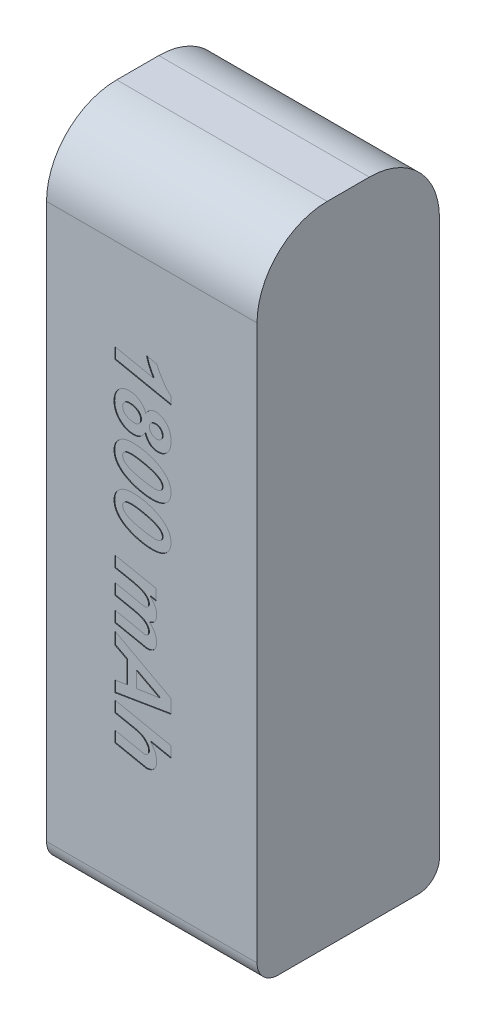
from build123d import *

# Parameters (mm, degrees)
SKETCH1_W           = 30
SKETCH1_H           = 92
BOSS_EXTRUDE1_DEPTH = 26
FILLET1_R           = 10
FILLET2_R           = 3
CUT_EXTRUDE1_DEPTH  = 0.1


with BuildPart() as part:
    # Sketch1 → Boss-Extrude1 (new body)
    with BuildSketch(Plane.XY):
        Rectangle(SKETCH1_W, SKETCH1_H)
    extrude(amount=BOSS_EXTRUDE1_DEPTH)

    # Fillet1
    fillet1_edges = [part.edges().sort_by_distance(p)[0] for p in [
        (0, 46, 0),
        (0, 46, 26),
    ]]
    fillet(fillet1_edges, radius=FILLET1_R)

    # Fillet2
    fillet2_edges = [part.edges().sort_by_distance(p)[0] for p in [
        (0, -46, 26),
        (0, -46, 0),
    ]]
    fillet(fillet2_edges, radius=FILLET2_R)

    # Sketch2 → Cut-Extrude1 (cut)
    # profile 1 of 7: a face of its own
    with BuildSketch(Plane.XY.offset(26)):
        with BuildLine():
            Line((-0.750042616, 24.085480055), (0.690466643, 23.7767995))
            add(Edge.make_bspline(
                [(0.690466643, 23.7767995), (0.764245784, 23.620240153), (0.909160156, 23.312731836), (1.143525697, 22.870871551), (1.389006546, 22.457088896), (1.639855318, 22.068663084), (1.903368827, 21.709753131), (2.172427788, 21.375970632), (2.452578988, 21.070104803), (2.650695005, 20.884408422), (2.748337014, 20.792887463)],
                knots=[0, 0, 0, 0, 1.138131727, 2.235477977, 3.287822432, 4.301550447, 5.275074112, 6.214672494, 7.120096559, 8, 8, 8, 8], degree=3))
            Line((2.748337014, 20.792887463), (2.748337014, 19.733405764))
            Line((2.748337014, 19.733405764), (-5.277357431, 21.381309772))
            Line((-5.277357431, 21.381309772), (-5.277357431, 22.953651352))
            Line((-5.277357431, 22.953651352), (0.229053521, 21.823430359))
            add(Edge.make_bspline(
                [(0.229053521, 21.823430359), (0.175070155, 21.907004417), (0.064699865, 22.077873589), (-0.086493138, 22.350370315), (-0.233830594, 22.639855267), (-0.368468606, 22.943873736), (-0.492353739, 23.247537552), (-0.596329622, 23.541458011), (-0.685721571, 23.817267876), (-0.72915109, 23.99836453), (-0.750042616, 24.085480055)],
                knots=[0, 0, 0, 0, 0.963964861, 1.970849335, 3.018369519, 4.11099744, 5.192122585, 6.195827564, 7.132113005, 8, 8, 8, 8], degree=3))
        make_face()
    # profile 2 of 7: a face of its own
    with BuildSketch(Plane.XY.offset(26)):
        with BuildLine():
            add(Edge.make_bspline(
                [(-0.854543846, 16.905441716), (-0.808427004, 16.97731352), (-0.719137657, 17.116468461), (-0.563452514, 17.300335025), (-0.398535746, 17.457168951), (-0.222147883, 17.585016432), (-0.036092485, 17.686336725), (0.16107307, 17.757832289), (0.368170212, 17.80041449), (0.509670799, 17.806102454), (0.58114228, 17.808975426)],
                knots=[0, 0, 0, 0, 1.151289584, 2.229074894, 3.242024708, 4.215537115, 5.160342733, 6.091432162, 7.035988663, 8, 8, 8, 8], degree=3))
            add(Edge.make_bspline(
                [(0.58114228, 17.808975426), (0.666588229, 17.804812124), (0.840212385, 17.796352392), (1.101228464, 17.7404634), (1.361444034, 17.642021904), (1.621756104, 17.51431141), (1.870847457, 17.349176291), (2.093996428, 17.141459407), (2.287236427, 16.895964572), (2.452266135, 16.617495125), (2.585396775, 16.311454624), (2.680099977, 15.982383488), (2.737552858, 15.633612839), (2.744686411, 15.394416227), (2.748337014, 15.27200711)],
                knots=[0, 0, 0, 0, 0.827973999, 1.682423677, 2.572802156, 3.51794388, 4.487184314, 5.457217265, 6.458746256, 7.504230222, 8.585616686, 9.683336227, 10.814444883, 12, 12, 12, 12], degree=3))
            add(Edge.make_bspline(
                [(2.748337014, 15.27200711), (2.747029902, 15.184048034), (2.744489347, 15.013087218), (2.717970662, 14.763707607), (2.67567946, 14.528988524), (2.61383824, 14.309240384), (2.537679643, 14.103886126), (2.441369575, 13.914142273), (2.329527803, 13.738011795), (2.198295057, 13.579423425), (2.056608665, 13.436733293), (1.903444077, 13.312865294), (1.741203122, 13.208187401), (1.569386643, 13.123055429), (1.389682099, 13.053442435), (1.199120079, 13.008791387), (1.000142268, 12.978034408), (0.864222633, 12.974686106), (0.794967873, 12.972980055)],
                knots=[0, 0, 0, 0, 1.243087479, 2.416115084, 3.541007917, 4.610847531, 5.639465507, 6.632218593, 7.613661446, 8.582774162, 9.536362877, 10.452184577, 11.362158741, 12.260035995, 13.159190913, 14.079794841, 15.021603112, 16, 16, 16, 16], degree=3))
            add(Edge.make_bspline(
                [(0.794967873, 12.972980055), (0.746126902, 12.973551529), (0.649713385, 12.974679635), (0.507557197, 12.994380497), (0.369247518, 13.019755309), (0.237030171, 13.061519097), (0.109176198, 13.110876281), (-0.014208067, 13.17259483), (-0.132118705, 13.246422356), (-0.245851039, 13.330530388), (-0.353571283, 13.426580263), (-0.459089116, 13.531906081), (-0.555695812, 13.652435305), (-0.651836356, 13.780217608), (-0.739502074, 13.921680352), (-0.825048692, 14.072518867), (-0.905590647, 14.235153346), (-0.953734566, 14.348920107), (-0.97833761, 14.40705847)],
                knots=[0, 0, 0, 0, 0.961053458, 1.897147852, 2.822468421, 3.727334701, 4.623105372, 5.519994748, 6.439699394, 7.3601306, 8.302452841, 9.280228522, 10.292491547, 11.341721621, 12.428147908, 13.567190665, 14.756758571, 16, 16, 16, 16], degree=3))
            add(Edge.make_bspline(
                [(-0.97833761, 14.40705847), (-1.028815572, 14.325223733), (-1.126690858, 14.166548582), (-1.303462231, 13.958427892), (-1.491289072, 13.777940363), (-1.699441822, 13.634491167), (-1.922014456, 13.521394152), (-2.160721504, 13.443497206), (-2.414054326, 13.393028901), (-2.588479566, 13.387421833), (-2.677688377, 13.384554129)],
                knots=[0, 0, 0, 0, 1.104819615, 2.142212779, 3.13242676, 4.09372825, 5.039579334, 5.995029153, 6.974568898, 8, 8, 8, 8], degree=3))
            add(Edge.make_bspline(
                [(-2.677688377, 13.384554129), (-2.751704312, 13.38669719), (-2.899097229, 13.39096481), (-3.117709381, 13.416341741), (-3.331137875, 13.46189882), (-3.538802736, 13.525383267), (-3.742564906, 13.603134026), (-3.939298182, 13.703372608), (-4.132879105, 13.817739578), (-4.254537301, 13.908082132), (-4.315946117, 13.953683904)],
                knots=[0, 0, 0, 0, 1.005550638, 2.00242071, 2.984724643, 3.965786964, 4.949950379, 5.94290545, 6.961650381, 8, 8, 8, 8], degree=3))
            add(Edge.make_bspline(
                [(-4.315946117, 13.953683904), (-4.400656404, 14.024233065), (-4.567316251, 14.163032174), (-4.785749211, 14.399407393), (-4.969559331, 14.656181873), (-5.118631027, 14.932198005), (-5.238217126, 15.226112655), (-5.320778623, 15.540009343), (-5.371898215, 15.872677527), (-5.377428106, 16.100860698), (-5.380250949, 16.217341311)],
                knots=[0, 0, 0, 0, 1.018279677, 2.003373381, 2.965682026, 3.929990586, 4.896840818, 5.891837577, 6.923846788, 8, 8, 8, 8], degree=3))
            add(Edge.make_bspline(
                [(-5.380250949, 16.217341311), (-5.37847832, 16.302103313), (-5.375000832, 16.468386798), (-5.345444047, 16.710962307), (-5.298284551, 16.941278059), (-5.227468632, 17.157436298), (-5.142422634, 17.363097198), (-5.032164793, 17.553234816), (-4.907905694, 17.73370191), (-4.760083475, 17.896098232), (-4.60129138, 18.045974345), (-4.42783548, 18.174485994), (-4.245562392, 18.285478368), (-4.051341501, 18.373439302), (-3.847365267, 18.443355085), (-3.632394477, 18.492624184), (-3.406929114, 18.524366952), (-3.252822172, 18.527590924), (-3.174471146, 18.529230055)],
                knots=[0, 0, 0, 0, 1.1327941, 2.222280578, 3.26208437, 4.270334757, 5.25905053, 6.231222848, 7.20318395, 8.182510492, 9.160893155, 10.118060599, 11.062922249, 12.008652688, 12.962489536, 13.940898431, 14.953111921, 16, 16, 16, 16], degree=3))
            add(Edge.make_bspline(
                [(-3.174471146, 18.529230055), (-3.108490102, 18.528195405), (-2.978327886, 18.526154329), (-2.786086942, 18.50388829), (-2.598826008, 18.470970442), (-2.417358102, 18.422216398), (-2.240729214, 18.361271108), (-2.070260706, 18.28494067), (-1.903793966, 18.196522156), (-1.744163536, 18.094277267), (-1.593180254, 17.979667252), (-1.451260109, 17.856700624), (-1.322363281, 17.722125881), (-1.204295973, 17.579219092), (-1.099485411, 17.424647198), (-1.004921185, 17.261600741), (-0.921679657, 17.088071768), (-0.877148369, 16.966932972), (-0.854543846, 16.905441716)],
                knots=[0, 0, 0, 0, 1.045558724, 2.062596037, 3.064149922, 4.057453873, 5.03817922, 6.023310694, 7.015342134, 8.024041474, 9.024874402, 10.018323679, 10.997723323, 11.975684761, 12.953646199, 13.954767572, 14.961819704, 16, 16, 16, 16], degree=3))
        make_face()
        with BuildLine():
            add(Edge.make_bspline(
                [(0.466994783, 16.265572648), (0.409403636, 16.263445786), (0.298567213, 16.259352556), (0.140886899, 16.218353552), (0.001361327, 16.149229384), (-0.119573872, 16.056354906), (-0.217214854, 15.941157047), (-0.287188837, 15.80833091), (-0.330876053, 15.659476365), (-0.335871813, 15.55474174), (-0.338468542, 15.500302104)],
                knots=[0, 0, 0, 0, 1.106364575, 2.129242073, 3.106838711, 4.084435348, 5.042921873, 5.988509993, 6.954454809, 8, 8, 8, 8], degree=3))
            add(Edge.make_bspline(
                [(-0.338468542, 15.500302104), (-0.334979541, 15.436562266), (-0.328085892, 15.31062358), (-0.265642085, 15.129328479), (-0.169798875, 14.95939766), (-0.036774397, 14.807911985), (0.120548957, 14.679802435), (0.295778394, 14.58474368), (0.485502333, 14.527734456), (0.61613113, 14.520204467), (0.682428087, 14.516382833)],
                knots=[0, 0, 0, 0, 0.973996038, 1.924444518, 2.906335947, 3.948464692, 4.993694825, 6.000375204, 6.985146891, 8, 8, 8, 8], degree=3))
            add(Edge.make_bspline(
                [(0.682428087, 14.516382833), (0.741679781, 14.5183113), (0.855921134, 14.522029517), (1.017630527, 14.565820886), (1.162680404, 14.633445662), (1.286927187, 14.729529934), (1.38888348, 14.845950061), (1.460874314, 14.982083879), (1.506087082, 15.132505567), (1.511059181, 15.238451938), (1.513614792, 15.292907356)],
                knots=[0, 0, 0, 0, 1.111341082, 2.142742289, 3.125290229, 4.10276144, 5.074398193, 6.012107247, 6.978242197, 8, 8, 8, 8], degree=3))
            add(Edge.make_bspline(
                [(1.513614792, 15.292907356), (1.509982731, 15.357659955), (1.502845439, 15.484904033), (1.443470408, 15.668159562), (1.347181072, 15.836779565), (1.212733224, 15.983716058), (1.055559446, 16.109807244), (0.875263298, 16.201523658), (0.676481236, 16.256168297), (0.538082706, 16.26238134), (0.466994783, 16.265572648)],
                knots=[0, 0, 0, 0, 0.97681722, 1.919524607, 2.880974977, 3.890620521, 4.911477692, 5.911263244, 6.927127631, 8, 8, 8, 8], degree=3))
        make_face(mode=Mode.SUBTRACT)
        with BuildLine():
            add(Edge.make_bspline(
                [(-3.201802237, 16.985827278), (-3.271702086, 16.983315658), (-3.404966137, 16.978527256), (-3.59361765, 16.935244626), (-3.758236275, 16.860072568), (-3.897355637, 16.756927516), (-4.008815302, 16.629648409), (-4.088626297, 16.482509718), (-4.137009531, 16.316775854), (-4.142617137, 16.200529022), (-4.145528727, 16.140171172)],
                knots=[0, 0, 0, 0, 1.173668912, 2.237599585, 3.228987459, 4.194508581, 5.126513387, 6.049465778, 6.987240761, 8, 8, 8, 8], degree=3))
            add(Edge.make_bspline(
                [(-4.145528727, 16.140171172), (-4.144074451, 16.092903497), (-4.141244788, 16.000932187), (-4.116470912, 15.866686526), (-4.074940998, 15.741045031), (-4.015831485, 15.624329631), (-3.943087519, 15.514728042), (-3.851707003, 15.414429005), (-3.743310766, 15.32335235), (-3.580003177, 15.212445595), (-3.357127164, 15.099385125), (-3.074359865, 15.000385034), (-2.780048635, 14.938449371), (-2.579379882, 14.931470933), (-2.478332185, 14.927956907)],
                knots=[0, 0, 0, 0, 0.742320717, 1.444374164, 2.136814516, 2.814762733, 3.494487192, 4.198104852, 4.938943078, 5.714487978, 7.296479243, 8.849328569, 10.413464543, 12, 12, 12, 12], degree=3))
            add(Edge.make_bspline(
                [(-2.478332185, 14.927956907), (-2.414729084, 14.930125022), (-2.29206288, 14.934306491), (-2.117954271, 14.983947488), (-1.960360748, 15.058934066), (-1.825351816, 15.167249632), (-1.711858828, 15.295473085), (-1.63218188, 15.446155987), (-1.58133338, 15.612272326), (-1.575963192, 15.729282259), (-1.573190764, 15.789690125)],
                knots=[0, 0, 0, 0, 1.087996936, 2.098332519, 3.081017277, 4.063142799, 5.047374551, 5.997568811, 6.966219445, 8, 8, 8, 8], degree=3))
            add(Edge.make_bspline(
                [(-1.573190764, 15.789690125), (-1.574299201, 15.828366812), (-1.576502024, 15.905229903), (-1.598185459, 16.018799117), (-1.634223957, 16.128519017), (-1.68205491, 16.235504456), (-1.746582242, 16.337718097), (-1.823252329, 16.437105072), (-1.915121576, 16.532563699), (-2.017983045, 16.625083047), (-2.133194821, 16.709592613), (-2.258169495, 16.784844751), (-2.393357681, 16.846543007), (-2.537110238, 16.89915807), (-2.690569674, 16.936118541), (-2.852427343, 16.966509216), (-3.02414704, 16.981319862), (-3.141761458, 16.984303941), (-3.201802237, 16.985827278)],
                knots=[0, 0, 0, 0, 0.827876832, 1.645259083, 2.465779707, 3.298102399, 4.148751074, 5.048934446, 5.98282208, 6.982951801, 8.009357285, 9.039096096, 10.102337211, 11.188148193, 12.313069887, 13.479578783, 14.713354584, 16, 16, 16, 16], degree=3))
        make_face(mode=Mode.SUBTRACT)
    # profile 3 of 7: a face of its own
    with BuildSketch(Plane.XY.offset(26)):
        with BuildLine():
            add(Edge.make_bspline(
                [(-2.65518042, 12.355618944), (-2.554938167, 12.354356506), (-2.353735613, 12.351822586), (-2.051722684, 12.331999367), (-1.748864005, 12.299178586), (-1.444469387, 12.256655), (-1.139382419, 12.198391878), (-0.833567191, 12.126651416), (-0.525994528, 12.046355028), (-0.323161883, 11.980430533), (-0.221105622, 11.947260293)],
                knots=[0, 0, 0, 0, 0.970574475, 1.948101311, 2.929147607, 3.91983513, 4.923296139, 5.935307402, 6.961139578, 8, 8, 8, 8], degree=3))
            add(Edge.make_bspline(
                [(-0.221105622, 11.947260293), (-0.099632304, 11.904834034), (0.137597962, 11.82197804), (0.478375384, 11.684435307), (0.794137544, 11.536135361), (1.086459724, 11.380087943), (1.355471301, 11.215655566), (1.598862148, 11.039075814), (1.820054406, 10.856949496), (2.015735277, 10.664289334), (2.187645473, 10.464836666), (2.338317727, 10.260739696), (2.464691387, 10.050200038), (2.568378221, 9.83390235), (2.648523881, 9.61184539), (2.707535634, 9.384944688), (2.741890916, 9.151974781), (2.746175466, 8.99454167), (2.748337014, 8.915116919)],
                knots=[0, 0, 0, 0, 1.35856178, 2.653191485, 3.878435275, 5.04050051, 6.150819564, 7.204674358, 8.213237606, 9.173610805, 10.100437584, 10.991199894, 11.849109469, 12.68944495, 13.520044858, 14.338058013, 15.161552938, 16, 16, 16, 16], degree=3))
            add(Edge.make_bspline(
                [(2.748337014, 8.915116919), (2.746102236, 8.836231637), (2.741704889, 8.681009989), (2.709183277, 8.453528234), (2.654835585, 8.236616927), (2.57646161, 8.031150058), (2.478537764, 7.835369008), (2.357018263, 7.650886417), (2.212189963, 7.478716261), (2.049190116, 7.315745411), (1.863703707, 7.169538762), (1.658286234, 7.041072663), (1.431133699, 6.936226104), (1.186332324, 6.846677041), (0.920372401, 6.780579123), (0.635798681, 6.7303431), (0.33038911, 6.701714262), (0.120323654, 6.698257668), (0.012012506, 6.696475426)],
                knots=[0, 0, 0, 0, 0.952593624, 1.874407366, 2.76926009, 3.64807316, 4.525192096, 5.408475348, 6.309347799, 7.238495603, 8.187740599, 9.155865717, 10.157722511, 11.204031341, 12.299844695, 13.462986106, 14.691898745, 16, 16, 16, 16], degree=3))
            add(Edge.make_bspline(
                [(0.012012506, 6.696475426), (-0.090392021, 6.697447001), (-0.297057149, 6.699407763), (-0.609109083, 6.724059929), (-0.925685276, 6.758471171), (-1.246907555, 6.809001266), (-1.571756722, 6.873414286), (-1.901916771, 6.950387451), (-2.234941011, 7.044536866), (-2.569678218, 7.148612428), (-2.896016987, 7.266185829), (-3.206674596, 7.394844102), (-3.498521403, 7.532007857), (-3.768541751, 7.682650664), (-4.021049191, 7.839598939), (-4.252597198, 8.008367263), (-4.464241785, 8.187403341), (-4.65553028, 8.375473864), (-4.827347275, 8.570851961), (-4.972819215, 8.776464872), (-5.100511144, 8.985203401), (-5.200852377, 9.202252696), (-5.283610881, 9.423566263), (-5.338558799, 9.652539221), (-5.374017553, 9.887206939), (-5.378160765, 10.045744058), (-5.380250949, 10.125723473)],
                knots=[0, 0, 0, 0, 1.050806483, 2.120658748, 3.210973163, 4.318753979, 5.456804918, 6.609528892, 7.79725842, 9.008045952, 10.206842645, 11.356004784, 12.458241288, 13.51444672, 14.527774803, 15.508034718, 16.45247093, 17.370395003, 18.259351987, 19.118717754, 19.952604299, 20.767053424, 21.569225787, 22.373657901, 23.179536685, 24, 24, 24, 24], degree=3))
            add(Edge.make_bspline(
                [(-5.380250949, 10.125723473), (-5.378033119, 10.205144323), (-5.373683588, 10.36090168), (-5.341152175, 10.588939212), (-5.286425551, 10.806248899), (-5.208731981, 11.012484715), (-5.110572836, 11.208809489), (-4.988264344, 11.392702259), (-4.846479869, 11.567509862), (-4.682059228, 11.729721753), (-4.497414251, 11.877830042), (-4.291830344, 12.00766899), (-4.065487185, 12.114329127), (-3.820741571, 12.203593775), (-3.556775416, 12.27163174), (-3.273613623, 12.321800336), (-2.970882387, 12.350332345), (-2.762420731, 12.353823147), (-2.65518042, 12.355618944)],
                knots=[0, 0, 0, 0, 0.959835819, 1.88239598, 2.777973292, 3.663560688, 4.541389852, 5.425388324, 6.327874184, 7.257774346, 8.211821364, 9.184167677, 10.18961518, 11.230681958, 12.32900772, 13.480331115, 14.703790039, 16, 16, 16, 16], degree=3))
        make_face()
        with BuildLine():
            add(Edge.make_bspline(
                [(-2.978330376, 10.812216167), (-3.029793358, 10.811647484), (-3.129064735, 10.810550502), (-3.272348277, 10.800843077), (-3.403917104, 10.785218525), (-3.523308037, 10.763157038), (-3.630786976, 10.733896416), (-3.72695335, 10.699350586), (-3.811619187, 10.657897692), (-3.904294822, 10.593917786), (-4.000549358, 10.50308323), (-4.084382711, 10.374792438), (-4.137453885, 10.230970159), (-4.142797866, 10.129397442), (-4.145528727, 10.077492136)],
                knots=[0, 0, 0, 0, 1.191284648, 2.297971535, 3.322843454, 4.257211969, 5.105948726, 5.898802233, 6.620089781, 7.280788094, 8.500482449, 9.656687857, 10.802529496, 12, 12, 12, 12], degree=3))
            add(Edge.make_bspline(
                [(-4.145528727, 10.077492136), (-4.144318642, 10.042027353), (-4.141898888, 9.971109957), (-4.121601646, 9.867112657), (-4.091304138, 9.765142683), (-4.045756963, 9.667909457), (-3.988489133, 9.573170501), (-3.919085334, 9.481532489), (-3.836775281, 9.392535122), (-3.774169123, 9.338423895), (-3.741993209, 9.310613881)],
                knots=[0, 0, 0, 0, 0.948578972, 1.896832437, 2.827118289, 3.790017463, 4.761852259, 5.786166786, 6.862218838, 8, 8, 8, 8], degree=3))
            add(Edge.make_bspline(
                [(-3.741993209, 9.310613881), (-3.6923869, 9.272509587), (-3.586160094, 9.190913163), (-3.399474257, 9.085274246), (-3.181027076, 8.983244981), (-2.931149768, 8.881741373), (-2.648010074, 8.784727166), (-2.332536848, 8.690344725), (-1.984582716, 8.598464188), (-1.740585338, 8.543467789), (-1.613383545, 8.514796823)],
                knots=[0, 0, 0, 0, 0.655059745, 1.40274305, 2.242041047, 3.181963106, 4.228381407, 5.378256922, 6.633221284, 8, 8, 8, 8], degree=3))
            add(Edge.make_bspline(
                [(-1.613383545, 8.514796823), (-1.51108821, 8.493060867), (-1.312154041, 8.450790862), (-1.021789867, 8.394259203), (-0.747272236, 8.347467242), (-0.489418366, 8.309138897), (-0.247818854, 8.277540093), (-0.023066112, 8.257192135), (0.185472946, 8.243244324), (0.31906546, 8.240972262), (0.383393799, 8.239878204)],
                knots=[0, 0, 0, 0, 1.243133213, 2.417526402, 3.516130667, 4.5530903, 5.516278402, 6.41196453, 7.235318791, 8, 8, 8, 8], degree=3))
            add(Edge.make_bspline(
                [(0.383393799, 8.239878204), (0.431641473, 8.240459725), (0.525023895, 8.241585249), (0.659755842, 8.251177765), (0.784332167, 8.267111694), (0.89783585, 8.288993358), (1.001386115, 8.317956709), (1.093585584, 8.354966477), (1.176810065, 8.396142081), (1.270315841, 8.460235489), (1.365739582, 8.553785624), (1.45327138, 8.681868566), (1.505166359, 8.827213049), (1.51076699, 8.929183355), (1.513614792, 8.981033079)],
                knots=[0, 0, 0, 0, 1.141149765, 2.208672892, 3.19294589, 4.110294096, 4.940858612, 5.731783298, 6.457439898, 7.132505598, 8.405449742, 9.593782183, 10.77648959, 12, 12, 12, 12], degree=3))
            add(Edge.make_bspline(
                [(1.513614792, 8.981033079), (1.512211791, 9.014848448), (1.509431193, 9.081866917), (1.492193223, 9.181313426), (1.458294798, 9.276596959), (1.416017906, 9.370370812), (1.357740887, 9.459132233), (1.289974848, 9.547176574), (1.208447548, 9.631713075), (1.146500057, 9.683110105), (1.114902407, 9.709326265)],
                knots=[0, 0, 0, 0, 0.943746662, 1.870405658, 2.801756019, 3.758205726, 4.73282665, 5.755564179, 6.855177262, 8, 8, 8, 8], degree=3))
            add(Edge.make_bspline(
                [(1.114902407, 9.709326265), (1.062533895, 9.748912446), (0.952792172, 9.83186794), (0.765057862, 9.942136825), (0.551276448, 10.048632992), (0.311090479, 10.154275898), (0.041665185, 10.250546641), (-0.254367277, 10.34524558), (-0.577491695, 10.437287932), (-0.803416381, 10.491518023), (-0.920460006, 10.519612723)],
                knots=[0, 0, 0, 0, 0.713497473, 1.495181721, 2.363192774, 3.310694001, 4.346972086, 5.47321942, 6.690963956, 8, 8, 8, 8], degree=3))
            add(Edge.make_bspline(
                [(-0.920460006, 10.519612723), (-1.022713673, 10.543127741), (-1.222479936, 10.589067485), (-1.515778192, 10.648243325), (-1.79515246, 10.697907339), (-2.059103261, 10.741071443), (-2.309848421, 10.770122191), (-2.544872675, 10.796100428), (-2.766509272, 10.808650466), (-2.909187716, 10.81105225), (-2.978330376, 10.812216167)],
                knots=[0, 0, 0, 0, 1.20901909, 2.361981057, 3.447338285, 4.478848738, 5.443197291, 6.355692098, 7.203160476, 8, 8, 8, 8], degree=3))
        make_face(mode=Mode.SUBTRACT)
    # profile 4 of 7: a face of its own
    with BuildSketch(Plane.XY.offset(26)):
        with BuildLine():
            add(Edge.make_bspline(
                [(-2.65518042, 6.182007833), (-2.554938167, 6.180745395), (-2.353735613, 6.178211474), (-2.051722684, 6.158388256), (-1.748864005, 6.125567475), (-1.444469387, 6.083043889), (-1.139382419, 6.024780767), (-0.833567191, 5.953040304), (-0.525994528, 5.872743917), (-0.323161883, 5.806819422), (-0.221105622, 5.773649182)],
                knots=[0, 0, 0, 0, 0.970574475, 1.948101311, 2.929147607, 3.91983513, 4.923296139, 5.935307402, 6.961139578, 8, 8, 8, 8], degree=3))
            add(Edge.make_bspline(
                [(-0.221105622, 5.773649182), (-0.099632304, 5.731222923), (0.137597962, 5.648366929), (0.478375384, 5.510824196), (0.794137544, 5.36252425), (1.086459724, 5.206476832), (1.355471301, 5.042044455), (1.598862148, 4.865464702), (1.820054406, 4.683338385), (2.015735277, 4.490678223), (2.187645473, 4.291225555), (2.338317727, 4.087128585), (2.464691387, 3.876588927), (2.568378221, 3.660291238), (2.648523881, 3.438234278), (2.707535634, 3.211333577), (2.741890916, 2.97836367), (2.746175466, 2.820930559), (2.748337014, 2.741505808)],
                knots=[0, 0, 0, 0, 1.35856178, 2.653191485, 3.878435275, 5.04050051, 6.150819564, 7.204674358, 8.213237606, 9.173610805, 10.100437584, 10.991199894, 11.849109469, 12.68944495, 13.520044858, 14.338058013, 15.161552938, 16, 16, 16, 16], degree=3))
            add(Edge.make_bspline(
                [(2.748337014, 2.741505808), (2.746102236, 2.662620526), (2.741704889, 2.507398878), (2.709183277, 2.279917123), (2.654835585, 2.063005816), (2.57646161, 1.857538947), (2.478537764, 1.661757897), (2.357018263, 1.477275306), (2.212189963, 1.30510515), (2.049190116, 1.1421343), (1.863703707, 0.99592765), (1.658286234, 0.867461552), (1.431133699, 0.762614993), (1.186332324, 0.673065929), (0.920372401, 0.606968012), (0.635798681, 0.556731989), (0.33038911, 0.528103151), (0.120323654, 0.524646557), (0.012012506, 0.522864315)],
                knots=[0, 0, 0, 0, 0.952593624, 1.874407366, 2.76926009, 3.64807316, 4.525192096, 5.408475348, 6.309347799, 7.238495603, 8.187740599, 9.155865717, 10.157722511, 11.204031341, 12.299844695, 13.462986106, 14.691898745, 16, 16, 16, 16], degree=3))
            add(Edge.make_bspline(
                [(0.012012506, 0.522864315), (-0.090392021, 0.52383589), (-0.297057149, 0.525796651), (-0.609109083, 0.550448818), (-0.925685276, 0.584860059), (-1.246907555, 0.635390155), (-1.571756722, 0.699803175), (-1.901916771, 0.77677634), (-2.234941011, 0.870925755), (-2.569678218, 0.975001317), (-2.896016987, 1.092574718), (-3.206674596, 1.22123299), (-3.498521403, 1.358396746), (-3.768541751, 1.509039553), (-4.021049191, 1.665987828), (-4.252597198, 1.834756152), (-4.464241785, 2.01379223), (-4.65553028, 2.201862753), (-4.827347275, 2.39724085), (-4.972819215, 2.602853761), (-5.100511144, 2.81159229), (-5.200852377, 3.028641585), (-5.283610881, 3.249955152), (-5.338558799, 3.47892811), (-5.374017553, 3.713595828), (-5.378160765, 3.872132946), (-5.380250949, 3.952112362)],
                knots=[0, 0, 0, 0, 1.050806483, 2.120658748, 3.210973163, 4.318753979, 5.456804918, 6.609528892, 7.79725842, 9.008045952, 10.206842645, 11.356004784, 12.458241288, 13.51444672, 14.527774803, 15.508034718, 16.45247093, 17.370395003, 18.259351987, 19.118717754, 19.952604299, 20.767053424, 21.569225787, 22.373657901, 23.179536685, 24, 24, 24, 24], degree=3))
            add(Edge.make_bspline(
                [(-5.380250949, 3.952112362), (-5.378033119, 4.031533212), (-5.373683588, 4.187290569), (-5.341152175, 4.415328101), (-5.286425551, 4.632637788), (-5.208731981, 4.838873604), (-5.110572836, 5.035198378), (-4.988264344, 5.219091148), (-4.846479869, 5.393898751), (-4.682059228, 5.556110642), (-4.497414251, 5.704218931), (-4.291830344, 5.834057879), (-4.065487185, 5.940718015), (-3.820741571, 6.029982664), (-3.556775416, 6.098020629), (-3.273613623, 6.148189225), (-2.970882387, 6.176721233), (-2.762420731, 6.180212036), (-2.65518042, 6.182007833)],
                knots=[0, 0, 0, 0, 0.959835819, 1.88239598, 2.777973292, 3.663560688, 4.541389852, 5.425388324, 6.327874184, 7.257774346, 8.211821364, 9.184167677, 10.18961518, 11.230681958, 12.32900772, 13.480331115, 14.703790039, 16, 16, 16, 16], degree=3))
        make_face()
        with BuildLine():
            add(Edge.make_bspline(
                [(-2.978330376, 4.638605055), (-3.029793358, 4.638036373), (-3.129064735, 4.636939391), (-3.272348277, 4.627231966), (-3.403917104, 4.611607414), (-3.523308037, 4.589545927), (-3.630786976, 4.560285305), (-3.72695335, 4.525739475), (-3.811619187, 4.484286581), (-3.904294822, 4.420306674), (-4.000549358, 4.329472119), (-4.084382711, 4.201181327), (-4.137453885, 4.057359048), (-4.142797866, 3.955786331), (-4.145528727, 3.903881025)],
                knots=[0, 0, 0, 0, 1.191284648, 2.297971535, 3.322843454, 4.257211969, 5.105948726, 5.898802233, 6.620089781, 7.280788094, 8.500482449, 9.656687857, 10.802529496, 12, 12, 12, 12], degree=3))
            add(Edge.make_bspline(
                [(-4.145528727, 3.903881025), (-4.144318642, 3.868416242), (-4.141898888, 3.797498846), (-4.121601646, 3.693501546), (-4.091304138, 3.591531572), (-4.045756963, 3.494298346), (-3.988489133, 3.399559389), (-3.919085334, 3.307921378), (-3.836775281, 3.218924011), (-3.774169123, 3.164812784), (-3.741993209, 3.13700277)],
                knots=[0, 0, 0, 0, 0.948578972, 1.896832437, 2.827118289, 3.790017463, 4.761852259, 5.786166786, 6.862218838, 8, 8, 8, 8], degree=3))
            add(Edge.make_bspline(
                [(-3.741993209, 3.13700277), (-3.6923869, 3.098898476), (-3.586160094, 3.017302052), (-3.399474257, 2.911663135), (-3.181027076, 2.80963387), (-2.931149768, 2.708130262), (-2.648010074, 2.611116055), (-2.332536848, 2.516733614), (-1.984582716, 2.424853077), (-1.740585338, 2.369856678), (-1.613383545, 2.341185712)],
                knots=[0, 0, 0, 0, 0.655059745, 1.40274305, 2.242041047, 3.181963106, 4.228381407, 5.378256922, 6.633221284, 8, 8, 8, 8], degree=3))
            add(Edge.make_bspline(
                [(-1.613383545, 2.341185712), (-1.51108821, 2.319449756), (-1.312154041, 2.277179751), (-1.021789867, 2.220648092), (-0.747272236, 2.173856131), (-0.489418366, 2.135527786), (-0.247818854, 2.103928982), (-0.023066112, 2.083581023), (0.185472946, 2.069633213), (0.31906546, 2.067361151), (0.383393799, 2.066267092)],
                knots=[0, 0, 0, 0, 1.243133213, 2.417526402, 3.516130667, 4.5530903, 5.516278402, 6.41196453, 7.235318791, 8, 8, 8, 8], degree=3))
            add(Edge.make_bspline(
                [(0.383393799, 2.066267092), (0.431641473, 2.066848614), (0.525023895, 2.067974137), (0.659755842, 2.077566654), (0.784332167, 2.093500583), (0.89783585, 2.115382247), (1.001386115, 2.144345598), (1.093585584, 2.181355366), (1.176810065, 2.22253097), (1.270315841, 2.286624378), (1.365739582, 2.380174513), (1.45327138, 2.508257455), (1.505166359, 2.653601938), (1.51076699, 2.755572244), (1.513614792, 2.807421968)],
                knots=[0, 0, 0, 0, 1.141149765, 2.208672892, 3.19294589, 4.110294096, 4.940858612, 5.731783298, 6.457439898, 7.132505598, 8.405449742, 9.593782183, 10.77648959, 12, 12, 12, 12], degree=3))
            add(Edge.make_bspline(
                [(1.513614792, 2.807421968), (1.512211791, 2.841237336), (1.509431193, 2.908255806), (1.492193223, 3.007702315), (1.458294798, 3.102985848), (1.416017906, 3.196759701), (1.357740887, 3.285521122), (1.289974848, 3.373565463), (1.208447548, 3.458101964), (1.146500057, 3.509498994), (1.114902407, 3.535715154)],
                knots=[0, 0, 0, 0, 0.943746662, 1.870405658, 2.801756019, 3.758205726, 4.73282665, 5.755564179, 6.855177262, 8, 8, 8, 8], degree=3))
            add(Edge.make_bspline(
                [(1.114902407, 3.535715154), (1.062533895, 3.575301335), (0.952792172, 3.658256829), (0.765057862, 3.768525714), (0.551276448, 3.875021881), (0.311090479, 3.980664787), (0.041665185, 4.07693553), (-0.254367277, 4.171634469), (-0.577491695, 4.263676821), (-0.803416381, 4.317906912), (-0.920460006, 4.346001612)],
                knots=[0, 0, 0, 0, 0.713497473, 1.495181721, 2.363192774, 3.310694001, 4.346972086, 5.47321942, 6.690963956, 8, 8, 8, 8], degree=3))
            add(Edge.make_bspline(
                [(-0.920460006, 4.346001612), (-1.022713673, 4.36951663), (-1.222479936, 4.415456374), (-1.515778192, 4.474632214), (-1.79515246, 4.524296228), (-2.059103261, 4.567460332), (-2.309848421, 4.59651108), (-2.544872675, 4.622489317), (-2.766509272, 4.635039354), (-2.909187716, 4.637441139), (-2.978330376, 4.638605055)],
                knots=[0, 0, 0, 0, 1.20901909, 2.361981057, 3.447338285, 4.478848738, 5.443197291, 6.355692098, 7.203160476, 8, 8, 8, 8], degree=3))
        make_face(mode=Mode.SUBTRACT)
    # profile 5 of 7: a face of its own
    with BuildSketch(Plane.XY.offset(26)):
        with BuildLine():
            Line((0.587573125, -3.95139603), (0.587573125, -5.522129898))
            Line((0.587573125, -5.522129898), (-0.221105622, -5.359751064))
            add(Edge.make_bspline(
                [(-0.221105622, -5.359751064), (-0.148640698, -5.430430505), (-0.008108421, -5.567500168), (0.177476794, -5.78627113), (0.336297229, -6.005687749), (0.464990268, -6.229947533), (0.56473513, -6.457014803), (0.638904302, -6.686609409), (0.681482041, -6.919790154), (0.687478969, -7.076088728), (0.690466643, -7.153956794)],
                knots=[0, 0, 0, 0, 1.172488658, 2.273824227, 3.319897172, 4.30740562, 5.263966138, 6.189043825, 7.097780296, 8, 8, 8, 8], degree=3))
            add(Edge.make_bspline(
                [(0.690466643, -7.153956794), (0.689489648, -7.20650564), (0.687592443, -7.308549029), (0.674433965, -7.456709731), (0.654265944, -7.59607648), (0.623416842, -7.725998395), (0.585532105, -7.847505502), (0.536951871, -7.958742096), (0.480225867, -8.060901259), (0.395617526, -8.184515002), (0.267720913, -8.317365163), (0.088498366, -8.447577294), (-0.117759412, -8.545327773), (-0.267957592, -8.582073315), (-0.344899387, -8.600896898)],
                knots=[0, 0, 0, 0, 0.967398101, 1.878567982, 2.736751611, 3.557654071, 4.33462832, 5.077001608, 5.788095146, 6.483266145, 7.830254255, 9.158501191, 10.544389706, 12, 12, 12, 12], degree=3))
            add(Edge.make_bspline(
                [(-0.344899387, -8.600896898), (-0.273255627, -8.654374297), (-0.127738928, -8.762993033), (0.067783927, -8.961921572), (0.242954115, -9.194230367), (0.398430777, -9.45330851), (0.527814523, -9.730893572), (0.622234574, -10.018859537), (0.678640077, -10.313052046), (0.686515766, -10.511156085), (0.690466643, -10.610535931)],
                knots=[0, 0, 0, 0, 0.914321872, 1.85709267, 2.843631132, 3.887157514, 4.945194626, 5.972365719, 6.982827484, 8, 8, 8, 8], degree=3))
            add(Edge.make_bspline(
                [(0.690466643, -10.610535931), (0.689152658, -10.66631505), (0.68659364, -10.774946253), (0.669033473, -10.933173083), (0.63883207, -11.081879595), (0.595061344, -11.220610324), (0.540278754, -11.350731437), (0.473048988, -11.471109507), (0.393005586, -11.582058222), (0.301736709, -11.682708573), (0.200594305, -11.773048566), (0.090087746, -11.850369391), (-0.027395021, -11.917233146), (-0.154366675, -11.969283741), (-0.287503734, -12.0143353), (-0.430294606, -12.041757288), (-0.580213572, -12.060166275), (-0.682994475, -12.062640938), (-0.735573215, -12.06390688)],
                knots=[0, 0, 0, 0, 1.161889092, 2.262807552, 3.311547246, 4.317834644, 5.288247013, 6.247875612, 7.183568897, 8.132028391, 9.073034385, 10.00224527, 10.936939061, 11.882437388, 12.856822934, 13.859574372, 14.905040931, 16, 16, 16, 16], degree=3))
            add(Edge.make_bspline(
                [(-0.735573215, -12.06390688), (-0.76184084, -12.058588039), (-0.818703848, -12.047074043), (-0.911327082, -12.027357948), (-1.017379836, -12.005110467), (-1.138037924, -11.980846178), (-1.272075185, -11.953815795), (-1.420490798, -11.923122049), (-1.582677618, -11.888956829), (-1.695886896, -11.866567774), (-1.754862133, -11.854904421)],
                knots=[0, 0, 0, 0, 0.618175884, 1.338200166, 2.184277402, 3.117597748, 4.176976147, 5.338190967, 6.613357306, 8, 8, 8, 8], degree=3))
            Line((-1.754862133, -11.854904421), (-5.277357431, -11.13304208))
            Line((-5.277357431, -11.13304208), (-5.277357431, -9.5607005))
            Line((-5.277357431, -9.5607005), (-1.753254421, -10.282562841))
            add(Edge.make_bspline(
                [(-1.753254421, -10.282562841), (-1.701264221, -10.293244043), (-1.602637068, -10.313506641), (-1.463974271, -10.34257809), (-1.342212943, -10.366684084), (-1.238726594, -10.387302459), (-1.152949572, -10.404840442), (-1.085677807, -10.420000887), (-1.035641381, -10.429209198), (-1.008343249, -10.434734661), (-0.997630145, -10.436903119)],
                knots=[0, 0, 0, 0, 1.651671761, 3.133276736, 4.408802718, 5.514258568, 6.416962193, 7.133286291, 7.659859738, 8, 8, 8, 8], degree=3))
            add(Edge.make_bspline(
                [(-0.997630145, -10.436903119), (-0.956775268, -10.434952321), (-0.879005701, -10.431238867), (-0.768227465, -10.405920579), (-0.671544183, -10.359850253), (-0.587923492, -10.29662246), (-0.520277759, -10.214524296), (-0.473117605, -10.112881859), (-0.446653689, -9.993977024), (-0.443186318, -9.909174403), (-0.44136206, -9.864557922)],
                knots=[0, 0, 0, 0, 1.079448119, 2.054790462, 2.979485418, 3.888546289, 4.804089939, 5.760439387, 6.82171904, 8, 8, 8, 8], degree=3))
            add(Edge.make_bspline(
                [(-0.44136206, -9.864557922), (-0.443228098, -9.817257772), (-0.446952965, -9.722840216), (-0.476905014, -9.582943232), (-0.527231681, -9.447330957), (-0.597698653, -9.315923956), (-0.686515607, -9.188401009), (-0.795921663, -9.066007619), (-0.923449646, -8.945831874), (-1.019908986, -8.873280986), (-1.06997715, -8.835622737)],
                knots=[0, 0, 0, 0, 0.904708588, 1.805921831, 2.724306989, 3.664932845, 4.652269049, 5.691467263, 6.80173349, 8, 8, 8, 8], degree=3))
            add(Edge.make_bspline(
                [(-1.06997715, -8.835622737), (-1.110851741, -8.808205948), (-1.197349005, -8.750187575), (-1.342781259, -8.671448519), (-1.51103643, -8.599154936), (-1.699106537, -8.525606918), (-1.910407222, -8.459982254), (-2.142192038, -8.393320054), (-2.395971485, -8.331100295), (-2.573072958, -8.293837064), (-2.664826687, -8.274531519)],
                knots=[0, 0, 0, 0, 0.693983493, 1.46858162, 2.32817678, 3.275731911, 4.315601931, 5.447350253, 6.677508839, 8, 8, 8, 8], degree=3))
            Line((-2.664826687, -8.274531519), (-5.277357431, -7.737555969))
            Line((-5.277357431, -7.737555969), (-5.277357431, -6.165214389))
            Line((-5.277357431, -6.165214389), (-1.758077555, -6.879038174))
            add(Edge.make_bspline(
                [(-1.758077555, -6.879038174), (-1.709304304, -6.888649757), (-1.616603805, -6.906917938), (-1.484492467, -6.933507051), (-1.365305199, -6.953791105), (-1.259908935, -6.972090719), (-1.167601499, -6.984825369), (-1.08882147, -6.994345158), (-1.02349558, -7.001872734), (-0.98424731, -7.002540094), (-0.967083631, -7.002831938)],
                knots=[0, 0, 0, 0, 1.488711904, 2.829508612, 4.035286171, 5.109099452, 6.032831352, 6.825082702, 7.486196384, 8, 8, 8, 8], degree=3))
            add(Edge.make_bspline(
                [(-0.967083631, -7.002831938), (-0.930464366, -7.000972659), (-0.85935858, -6.997362386), (-0.75739154, -6.969396719), (-0.665530897, -6.922215051), (-0.586402369, -6.855386691), (-0.521119666, -6.77256573), (-0.474155604, -6.674386526), (-0.446689653, -6.562714748), (-0.443186945, -6.484235528), (-0.44136206, -6.443348431)],
                knots=[0, 0, 0, 0, 1.01641887, 1.973640412, 2.912623038, 3.863920331, 4.828984301, 5.821232108, 6.86487794, 8, 8, 8, 8], degree=3))
            add(Edge.make_bspline(
                [(-0.44136206, -6.443348431), (-0.44333048, -6.402468403), (-0.447365784, -6.318663442), (-0.477687706, -6.192974261), (-0.527332654, -6.065995084), (-0.594272054, -5.938384796), (-0.679383056, -5.814637333), (-0.777825095, -5.695567054), (-0.893004387, -5.586608053), (-1.022361776, -5.484361585), (-1.169530204, -5.391065786), (-1.33331284, -5.301420241), (-1.519296109, -5.224489709), (-1.650151733, -5.178018365), (-1.717884774, -5.153964027)],
                knots=[0, 0, 0, 0, 0.761174298, 1.560424149, 2.394822482, 3.296960137, 4.238514627, 5.188344014, 6.169916196, 7.186609, 8.25563779, 9.412663873, 10.660751916, 12, 12, 12, 12], degree=3))
            add(Edge.make_bspline(
                [(-1.717884774, -5.153964027), (-1.737180687, -5.146475668), (-1.780507088, -5.129661554), (-1.853132287, -5.101081091), (-1.943197869, -5.074278687), (-2.047346791, -5.03877981), (-2.168275767, -5.005211378), (-2.303805134, -4.963569129), (-2.45575012, -4.921108858), (-2.562468105, -4.891364428), (-2.618203061, -4.875829985)],
                knots=[0, 0, 0, 0, 0.526970844, 1.183242811, 1.985733913, 2.917645139, 3.983964362, 5.179633607, 6.527024327, 8, 8, 8, 8], degree=3))
            Line((-2.618203061, -4.875829985), (-5.277357431, -4.340462147))
            Line((-5.277357431, -4.340462147), (-5.277357431, -2.769728278))
            Line((-5.277357431, -2.769728278), (0.587573125, -3.95139603))
        make_face()
    # profile 6 of 7: a face of its own
    with BuildSketch(Plane.XY.offset(26)):
        Polygon((-3.528167616, -17.935268281), (-3.528167616, -14.800231388), (-5.277357431, -13.882228278), (-5.277357431, -12.153938709), (2.748337014, -16.478681909), (2.748337014, -18.428835627), (-5.277357431, -19.763235946), (-5.277357431, -18.203756056), align=None)
        Polygon((-2.190551875, -17.729481244), (1.102040718, -17.22626763), (-2.190551875, -15.499585772), align=None, mode=Mode.SUBTRACT)
    # profile 7 of 7: a face of its own
    with BuildSketch(Plane.XY.offset(26)):
        with BuildLine():
            Line((-5.277357431, -22.243934369), (-5.277357431, -20.6732005))
            Line((-5.277357431, -20.6732005), (2.748337014, -22.305027395))
            Line((2.748337014, -22.305027395), (2.748337014, -23.874153553))
            Line((2.748337014, -23.874153553), (-0.140720061, -23.287338955))
            add(Edge.make_bspline(
                [(-0.140720061, -23.287338955), (-0.071043959, -23.375486546), (0.062983749, -23.545045684), (0.238850087, -23.802397348), (0.383544456, -24.050915482), (0.498262947, -24.293300409), (0.585553483, -24.5359885), (0.646810032, -24.784252971), (0.682414319, -25.041391891), (0.687762331, -25.215412412), (0.690466643, -25.303408833)],
                knots=[0, 0, 0, 0, 1.209708193, 2.326973159, 3.353447844, 4.303490825, 5.210712318, 6.126101792, 7.052431664, 8, 8, 8, 8], degree=3))
            add(Edge.make_bspline(
                [(0.690466643, -25.303408833), (0.689271042, -25.361873664), (0.686938774, -25.475921341), (0.667587802, -25.642829002), (0.634141782, -25.800022907), (0.586971394, -25.94798554), (0.527745397, -26.086684769), (0.454926345, -26.215999719), (0.369413804, -26.336355377), (0.269438, -26.444602291), (0.160222359, -26.543396677), (0.041427409, -26.628414985), (-0.086122767, -26.699805674), (-0.220364449, -26.759625892), (-0.364147927, -26.804228411), (-0.515009608, -26.838600674), (-0.67506392, -26.857647323), (-0.784293388, -26.86005266), (-0.840074444, -26.861281012)],
                knots=[0, 0, 0, 0, 1.13830183, 2.220491854, 3.266448475, 4.263192721, 5.240237939, 6.198145625, 7.148061093, 8.10841018, 9.061759088, 10.011674556, 10.946274794, 11.904182481, 12.867927838, 13.873104696, 14.913841941, 16, 16, 16, 16], degree=3))
            add(Edge.make_bspline(
                [(-0.840074444, -26.861281012), (-0.870078605, -26.854820403), (-0.933783533, -26.841103217), (-1.035540387, -26.819864596), (-1.150144405, -26.798515334), (-1.275938571, -26.769496246), (-1.415434943, -26.74394398), (-1.566040749, -26.710348482), (-1.72962773, -26.677232882), (-1.842749118, -26.654415137), (-1.901163854, -26.642632285)],
                knots=[0, 0, 0, 0, 0.679899207, 1.443564153, 2.302674401, 3.261995957, 4.302705528, 5.443610768, 6.67990656, 8, 8, 8, 8], degree=3))
            Line((-1.901163854, -26.642632285), (-5.277357431, -25.949708747))
            Line((-5.277357431, -25.949708747), (-5.277357431, -24.377367167))
            Line((-5.277357431, -24.377367167), (-1.833639983, -25.084760107))
            add(Edge.make_bspline(
                [(-1.833639983, -25.084760107), (-1.789184288, -25.093991186), (-1.704080753, -25.111662657), (-1.582166281, -25.135003251), (-1.473044913, -25.157975954), (-1.376603567, -25.177393543), (-1.2922828, -25.193066193), (-1.220668151, -25.208006273), (-1.160472015, -25.218897519), (-1.124629205, -25.226186666), (-1.108562219, -25.229454117)],
                knots=[0, 0, 0, 0, 1.473771324, 2.82130674, 4.028986795, 5.093365789, 6.014488265, 6.81277251, 7.467810503, 8, 8, 8, 8], degree=3))
            add(Edge.make_bspline(
                [(-1.108562219, -25.229454117), (-1.060664928, -25.227453505), (-0.968392307, -25.223599388), (-0.836697989, -25.189447009), (-0.720974233, -25.130609107), (-0.620876876, -25.050540436), (-0.53959937, -24.949924422), (-0.481490669, -24.83069042), (-0.446925121, -24.694925836), (-0.443275338, -24.599444943), (-0.44136206, -24.549392268)],
                knots=[0, 0, 0, 0, 1.067902763, 2.057280981, 3.009516557, 3.945459151, 4.898220513, 5.871853974, 6.884390379, 8, 8, 8, 8], degree=3))
            add(Edge.make_bspline(
                [(-0.44136206, -24.549392268), (-0.444847463, -24.483124079), (-0.451838096, -24.350210718), (-0.506613056, -24.154822482), (-0.592137402, -23.963041883), (-0.673990847, -23.846131528), (-0.71628068, -23.785729435)],
                knots=[0, 0, 0, 0, 0.962096504, 1.929666123, 2.930355673, 4, 4, 4, 4], degree=3))
            add(Edge.make_bspline(
                [(-0.71628068, -23.785729435), (-0.778794161, -23.709570848), (-0.902266816, -23.559147245), (-1.118152005, -23.363549834), (-1.352672349, -23.194006007), (-1.524235109, -23.106226646), (-1.610168122, -23.062259383)],
                knots=[0, 0, 0, 0, 1.017577883, 2.009855189, 3.003168638, 4, 4, 4, 4], degree=3))
            add(Edge.make_bspline(
                [(-1.610168122, -23.062259383), (-1.638413836, -23.050058239), (-1.701993059, -23.022594275), (-1.812721136, -22.986988676), (-1.947052224, -22.946586017), (-2.106670171, -22.905702184), (-2.290409047, -22.860342783), (-2.499031289, -22.812704761), (-2.731941848, -22.76077199), (-2.895739562, -22.727565833), (-2.981545799, -22.710170625)],
                knots=[0, 0, 0, 0, 0.520596645, 1.171828402, 1.966914907, 2.895504841, 3.960457025, 5.170819639, 6.517919987, 8, 8, 8, 8], degree=3))
            Line((-2.981545799, -22.710170625), (-5.277357431, -22.243934369))
        make_face()
    extrude(amount=-CUT_EXTRUDE1_DEPTH, mode=Mode.SUBTRACT)


solid = part.part
